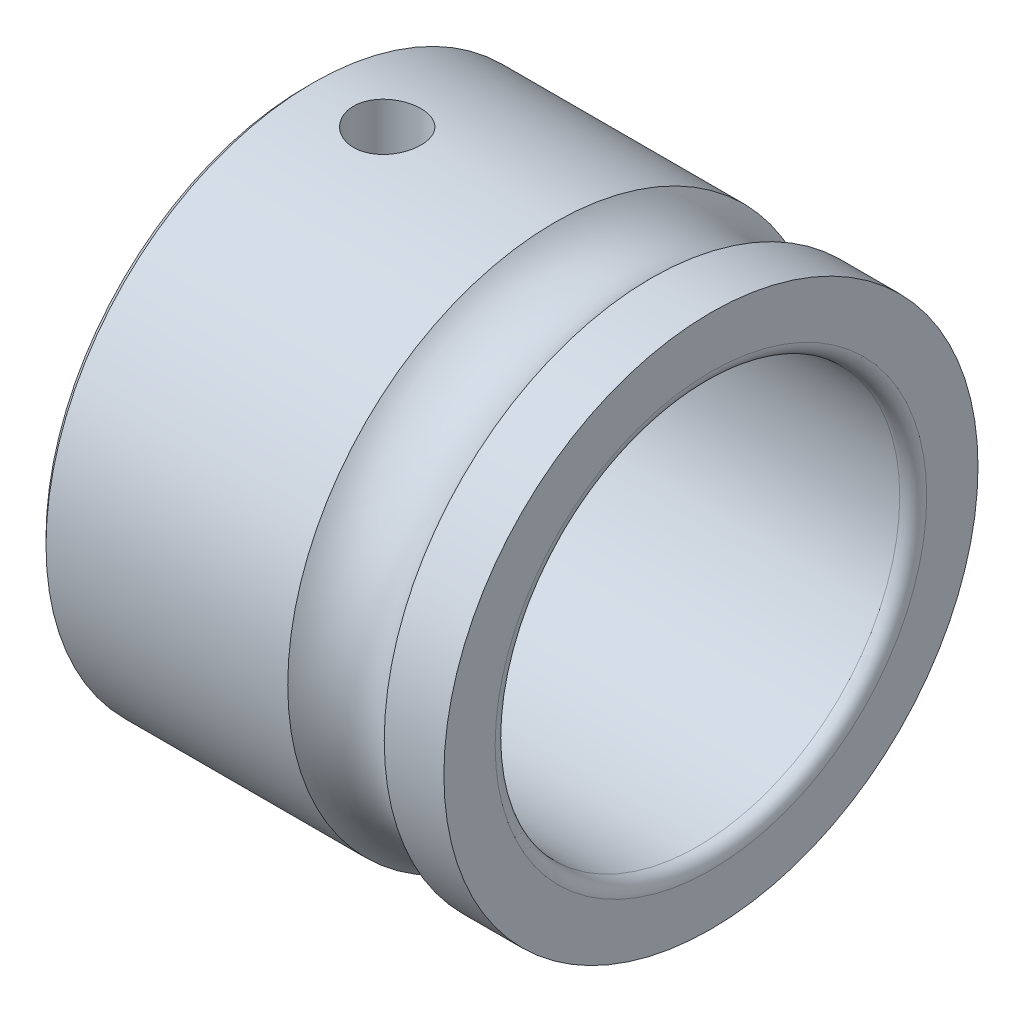
from build123d import *

# Parameters (mm, degrees)
EXTRUSION1_DEPTH             = 14
EXTRUSION1_DEPTH_BACK        = 2
ESQUISSE2_R                  = 19.8
ESQUISSE2_R_2                = 15
CONG_1_R                     = 1
CHANFREIN1_SIZE              = 0.5
ESQUISSE5_W                  = 2.5
ESQUISSE5_H                  = 19.8
R_P_TITION_CIRCULAIRE1_COUNT = 2
R_P_TITION_CIRCULAIRE1_ANGLE = 90


with BuildPart() as part:
    # Esquisse1 → Base-Révolution (revolve)
    with BuildSketch(Plane(origin=(0, 0, 0), x_dir=(1, 0, 0), z_dir=(0, 1, 0))):
        with BuildLine():
            Line((0, 19.8), (0, 16))
            ThreePointArc((0, 16), (0.292893219, 15.292893219), (1, 15))
            Line((1, 15), (15, 15))
            ThreePointArc((15, 15), (15.707106781, 15.292893219), (16, 16))
            Line((16, 16), (16, 19.8))
            Line((16, 19.8), (11.577708764, 19.8))
            ThreePointArc((11.577708764, 19.8), (8, 18.2), (4.422291236, 19.8))
            Line((4.422291236, 19.8), (0, 19.8))
        make_face()
    revolve(axis=Axis((0, 0, 0), (1, 0, 0)))

    # Esquisse2 → Extrusion1 (add, two sides: drawn at the far end of the back side and taken through both)
    with BuildSketch(Plane.ZY.offset(-EXTRUSION1_DEPTH_BACK)):
        Circle(ESQUISSE2_R)
        Circle(ESQUISSE2_R_2, mode=Mode.SUBTRACT)
    extrude(amount=EXTRUSION1_DEPTH + EXTRUSION1_DEPTH_BACK)

    # Congé1
    cong_1_edges = [part.edges().sort_by_distance(p)[0] for p in [
        (-14, 0, -15),
    ]]
    fillet(cong_1_edges, radius=CONG_1_R)

    # Chanfrein1
    chanfrein1_edges = [part.edges().sort_by_distance(p)[0] for p in [
        (-14, 0, -19.8),
    ]]
    chamfer(chanfrein1_edges, length=CHANFREIN1_SIZE)

    # Esquisse5 → Trou taraudé M61 (revolve, cut)
    with BuildSketch(Plane(origin=(-8, 0, 0), x_dir=(0, 0, -1), z_dir=(1, 0, 0))):
        with Locations((1.25, 9.9)):
            Rectangle(ESQUISSE5_W, ESQUISSE5_H)
    trou_taraud_m61 = revolve(axis=Axis((-8, -6.35, 0), (0, 1, 0)), mode=Mode.SUBTRACT)

    # Répétition circulaire1: Trou taraudé M61 ×2 about axis
    r_p_tition_circulaire1_axis = Axis((15, 0, 0), (-1, 0, 0))
    for i in range(1, R_P_TITION_CIRCULAIRE1_COUNT):
        add(trou_taraud_m61.rotate(r_p_tition_circulaire1_axis, i * R_P_TITION_CIRCULAIRE1_ANGLE / (R_P_TITION_CIRCULAIRE1_COUNT - 1)), mode=Mode.SUBTRACT)


solid = part.part
